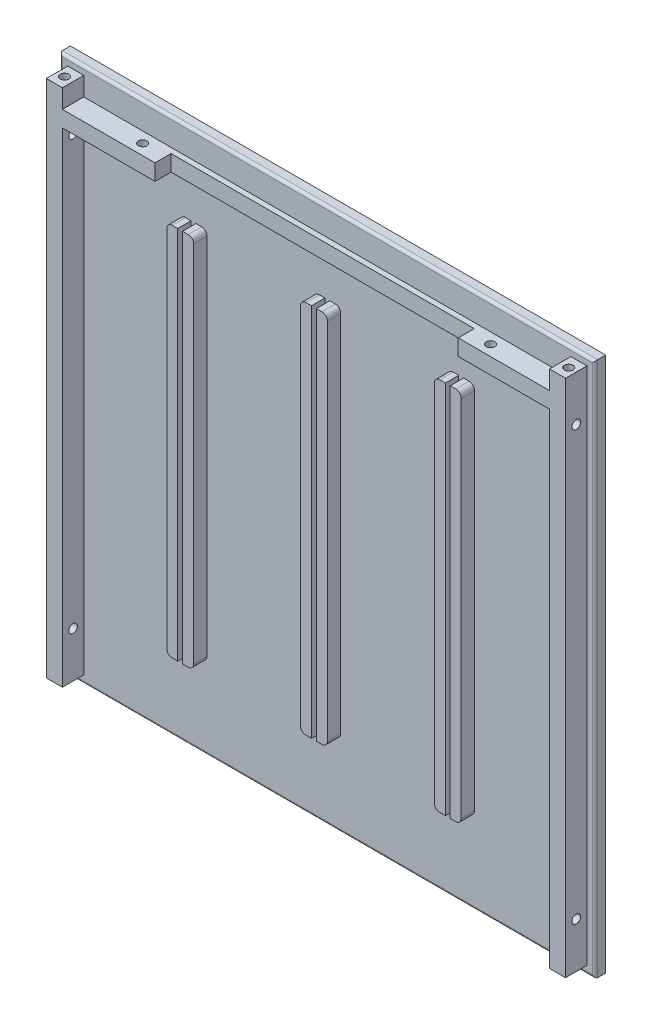
from build123d import *

# Parameters (mm, degrees)
ESQUISSE1_W                 = 200
ESQUISSE1_H                 = 200
BOSS_EXTRU_PAROIE_DEPTH     = 4
BOSS_EXTRU_BORDS_DEPTH      = 8
BOSS_EXTRU_GLISSIERES_DEPTH = 5
CONG_1_R                    = 1
ESQUISSE8_W                 = 1.8
ESQUISSE8_H                 = 180
ENL_V_MAT_EXTRU_6_DEPTH     = 283.955826941
ESQUISSE5_R                 = 1.6
ENL_V_MAT_EXTRU_2_DEPTH     = 10
ENL_V_START                 = -10
ESQUISSE6_R                 = 1.6
ENL_V_MAT_EXTRU_3_DEPTH     = 10
ESQUISSE7_R                 = 1.6
ENL_V_MAT_EXTRU_4_DEPTH     = 10
ESQUISSE10_R                = 1.6
ENL_V_MAT_EXTRU_8_DEPTH     = 10
ESQUISSE11_W                = 113.303164178
ESQUISSE11_H                = 6
ENL_V_MAT_EXTRU_9_DEPTH     = 6
ESQUISSE9_R                 = 1.6
ENL_V_MAT_EXTRU_10_DEPTH    = 10


with BuildPart() as part:
    # Esquisse1 → Boss.-Extru. Paroie (new body)
    with BuildSketch(Plane.XY):
        with Locations((100, 100)):
            Rectangle(ESQUISSE1_W, ESQUISSE1_H)
    extrude(amount=BOSS_EXTRU_PAROIE_DEPTH)

    # Esquisse4 → Boss.-Extru. Bords (add)
    with BuildSketch(Plane.XY.offset(4)):
        Polygon((3, 3), (9, 3), (9, 184), (191, 184), (191, 3), (197, 3), (197, 197), (191, 197), (191, 190), (9, 190), (9, 197), (3, 197), align=None)
    extrude(amount=BOSS_EXTRU_BORDS_DEPTH)

    # Esquisse2 → Boss.-Extru. Glissieres (add)
    with BuildSketch(Plane.XY.offset(4)):
        with BuildLine():
            Line((47, 170), (53, 170))
            ThreePointArc((53, 170), (54.414213562, 169.414213562), (55, 168))
            Line((55, 168), (55, 32))
            ThreePointArc((55, 32), (54.414213562, 30.585786438), (53, 30))
            Line((53, 30), (47, 30))
            ThreePointArc((47, 30), (45.585786438, 30.585786438), (45, 32))
            Line((45, 32), (45, 168))
            ThreePointArc((45, 168), (45.585786438, 169.414213562), (47, 170))
        make_face()
        with BuildLine():
            Line((97, 170), (103, 170))
            ThreePointArc((103, 170), (104.414213562, 169.414213562), (105, 168))
            Line((105, 168), (105, 32))
            ThreePointArc((105, 32), (104.414213562, 30.585786438), (103, 30))
            Line((103, 30), (97, 30))
            ThreePointArc((97, 30), (95.585786438, 30.585786438), (95, 32))
            Line((95, 32), (95, 168))
            ThreePointArc((95, 168), (95.585786438, 169.414213562), (97, 170))
        make_face()
        with BuildLine():
            Line((147, 170), (153, 170))
            ThreePointArc((153, 170), (154.414213562, 169.414213562), (155, 168))
            Line((155, 168), (155, 32))
            ThreePointArc((155, 32), (154.414213562, 30.585786438), (153, 30))
            Line((153, 30), (147, 30))
            ThreePointArc((147, 30), (145.585786438, 30.585786438), (145, 32))
            Line((145, 32), (145, 168))
            ThreePointArc((145, 168), (145.585786438, 169.414213562), (147, 170))
        make_face()
    extrude(amount=BOSS_EXTRU_GLISSIERES_DEPTH)

    # Congé1
    cong_1_edges = [part.edges().sort_by_distance(p)[0] for p in [
        (200, 100, 4),
        (100, 200, 4),
        (0, 100, 4),
        (100, 0, 4),
    ]]
    fillet(cong_1_edges, radius=CONG_1_R)

    # Esquisse8 → Enlèv. mat.-Extru.6 (cut, through all)
    with BuildSketch(Plane.XY.offset(4)):
        with Locations((100, 85)):
            Rectangle(ESQUISSE8_W, ESQUISSE8_H)
        with Locations((150, 85)):
            Rectangle(ESQUISSE8_W, ESQUISSE8_H)
        with Locations((50, 85)):
            Rectangle(ESQUISSE8_W, ESQUISSE8_H)
    extrude(amount=ENL_V_MAT_EXTRU_6_DEPTH, mode=Mode.SUBTRACT)

    # Esquisse5 → Enlèv. mat.-Extru.2 (cut)
    with BuildSketch(Plane.ZY.offset(-3)):
        with Locations((8, 180)):
            Circle(ESQUISSE5_R)
        with Locations((8, 20)):
            Circle(ESQUISSE5_R)
    extrude(amount=-ENL_V_MAT_EXTRU_2_DEPTH, mode=Mode.SUBTRACT)

    # Esquisse6 → Enlèv. mat.-Extru.3 (cut)
    with BuildSketch(Plane(origin=(197, 0, 0), x_dir=(0, 0, -1), z_dir=(1, 0, 0)).offset(ENL_V_START)):
        with Locations(Location((-8, 180, 0), (0, 0, 180))):
            Circle(ESQUISSE6_R)
        with Locations(Location((-8, 20, 0), (0, 0, 180))):
            Circle(ESQUISSE6_R)
    extrude(amount=ENL_V_MAT_EXTRU_3_DEPTH, mode=Mode.SUBTRACT)

    # Esquisse7 → Enlèv. mat.-Extru.4 (cut)
    with BuildSketch(Plane.XZ.offset(-184)):
        with Locations(Location((35, 8, 0), (0, 0, 270))):
            Circle(ESQUISSE7_R)
        with Locations(Location((165, 8, 0), (0, 0, 270))):
            Circle(ESQUISSE7_R)
    extrude(amount=-ENL_V_MAT_EXTRU_4_DEPTH, mode=Mode.SUBTRACT)

    # Esquisse10 → Enlèv. mat.-Extru.8 (cut)
    with BuildSketch(Plane(origin=(0, 3, 0), x_dir=(-1, 0, 0), z_dir=(0, -1, 0))):
        with Locations(Location((-194.2, -8, 0), (0, 0, 90))):
            Circle(ESQUISSE10_R)
        with Locations(Location((-5.8, -8, 0), (0, 0, 90))):
            Circle(ESQUISSE10_R)
    extrude(amount=-ENL_V_MAT_EXTRU_8_DEPTH, mode=Mode.SUBTRACT)

    # Esquisse11 → Enlèv. mat.-Extru.9 (cut)
    with BuildSketch(Plane.XY.offset(12)):
        with Locations((100.248809194, 187)):
            Rectangle(ESQUISSE11_W, ESQUISSE11_H)
    extrude(amount=-ENL_V_MAT_EXTRU_9_DEPTH, mode=Mode.SUBTRACT)

    # Esquisse9 → Enlèv. mat.-Extru.10 (cut)
    with BuildSketch(Plane(origin=(0, 197, 0), x_dir=(1, 0, 0), z_dir=(0, 1, 0)).offset(ENL_V_START)):
        with Locations(Location((194.2, -8, 0), (0, 0, 90))):
            Circle(ESQUISSE9_R)
        with Locations(Location((5.8, -8, 0), (0, 0, 90))):
            Circle(ESQUISSE9_R)
    extrude(amount=ENL_V_MAT_EXTRU_10_DEPTH, mode=Mode.SUBTRACT)


solid = part.part
